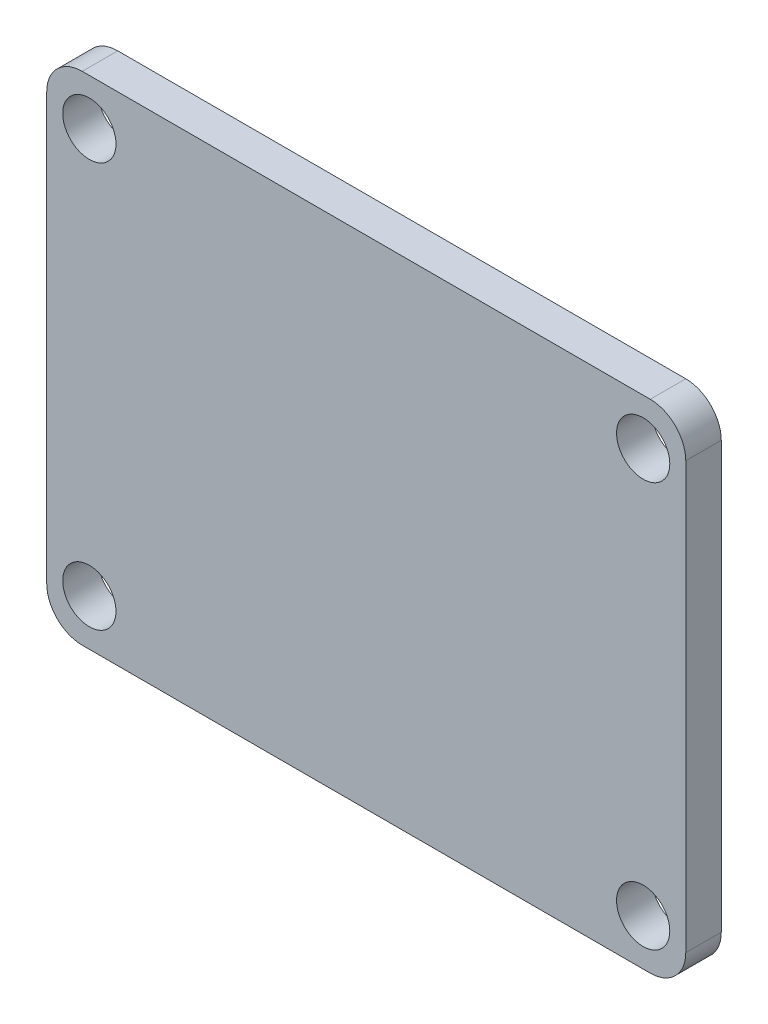
from build123d import *

# Parameters (mm, degrees)
SKETCH1_W           = 180
SKETCH1_H           = 140
BOSS_EXTRUDE1_DEPTH = 10
SKETCH2_R           = 7.5
CUT_EXTRUDE1_DEPTH  = 229.25424421
FILLET1_R           = 10


with BuildPart() as part:
    # Sketch1 → Boss-Extrude1 (new body)
    with BuildSketch(Plane.XY):
        with Locations((-90, 70)):
            Rectangle(SKETCH1_W, SKETCH1_H)
    extrude(amount=BOSS_EXTRUDE1_DEPTH)

    # Sketch2 → Cut-Extrude1 (cut, through all)
    with BuildSketch(Plane.XY.offset(10)):
        with Locations((-168, 127)):
            Circle(SKETCH2_R)
        with Locations((-12, 127)):
            Circle(SKETCH2_R)
        with Locations((-12, 13)):
            Circle(SKETCH2_R)
        with Locations((-168, 13)):
            Circle(SKETCH2_R)
    extrude(amount=-CUT_EXTRUDE1_DEPTH, mode=Mode.SUBTRACT)

    # Fillet1
    fillet1_edges = [part.edges().sort_by_distance(p)[0] for p in [
        (-180, 140, 5),
        (0, 140, 5),
        (0, 0, 5),
        (-180, 0, 5),
    ]]
    fillet(fillet1_edges, radius=FILLET1_R)


solid = part.part
